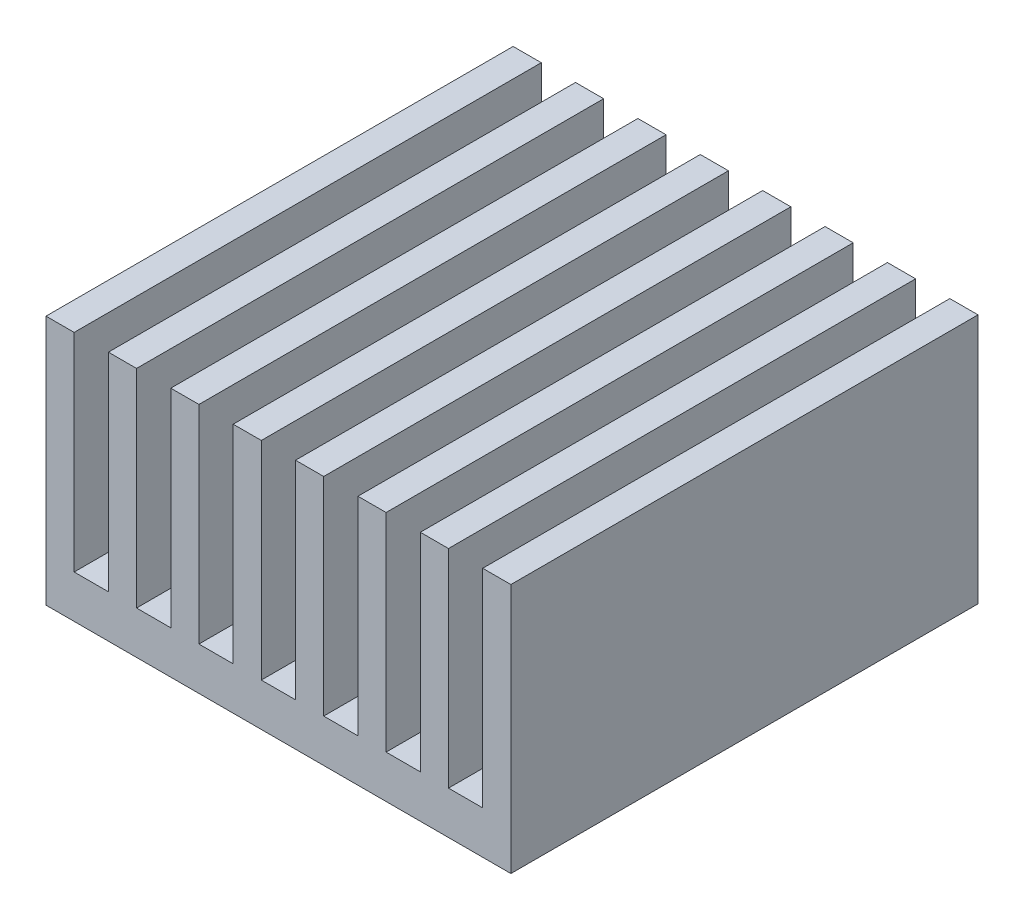
from build123d import *

# Parameters (mm, degrees)
SKETCH1_W           = 16.51
SKETCH1_H           = 16.59
BOSS_EXTRUDE1_DEPTH = 1.52
SKETCH2_W           = 1
SKETCH2_H           = 16.59
BOSS_EXTRUDE2_DEPTH = 7.37


with BuildPart() as part:
    # Sketch1 → Boss-Extrude1 (new body)
    with BuildSketch(Plane(origin=(0, 0, 0), x_dir=(1, 0, 0), z_dir=(0, 1, 0))):
        with Locations((8.255, 8.295)):
            Rectangle(SKETCH1_W, SKETCH1_H)
    extrude(amount=BOSS_EXTRUDE1_DEPTH)

    # Sketch2 → Boss-Extrude2 (add)
    with BuildSketch(Plane(origin=(0, 1.52, 0), x_dir=(1, 0, 0), z_dir=(0, 1, 0))):
        with Locations((0.5, 8.295)):
            Rectangle(SKETCH2_W, SKETCH2_H)
        with Locations((2.715714286, 8.295)):
            Rectangle(SKETCH2_W, SKETCH2_H)
        with Locations((4.931428571, 8.295)):
            Rectangle(SKETCH2_W, SKETCH2_H)
        with Locations((7.147142857, 8.295)):
            Rectangle(SKETCH2_W, SKETCH2_H)
        with Locations((9.362857143, 8.295)):
            Rectangle(SKETCH2_W, SKETCH2_H)
        with Locations((11.578571429, 8.295)):
            Rectangle(SKETCH2_W, SKETCH2_H)
        with Locations((13.794285714, 8.295)):
            Rectangle(SKETCH2_W, SKETCH2_H)
        with Locations((16.01, 8.295)):
            Rectangle(SKETCH2_W, SKETCH2_H)
    extrude(amount=BOSS_EXTRUDE2_DEPTH)


solid = part.part
